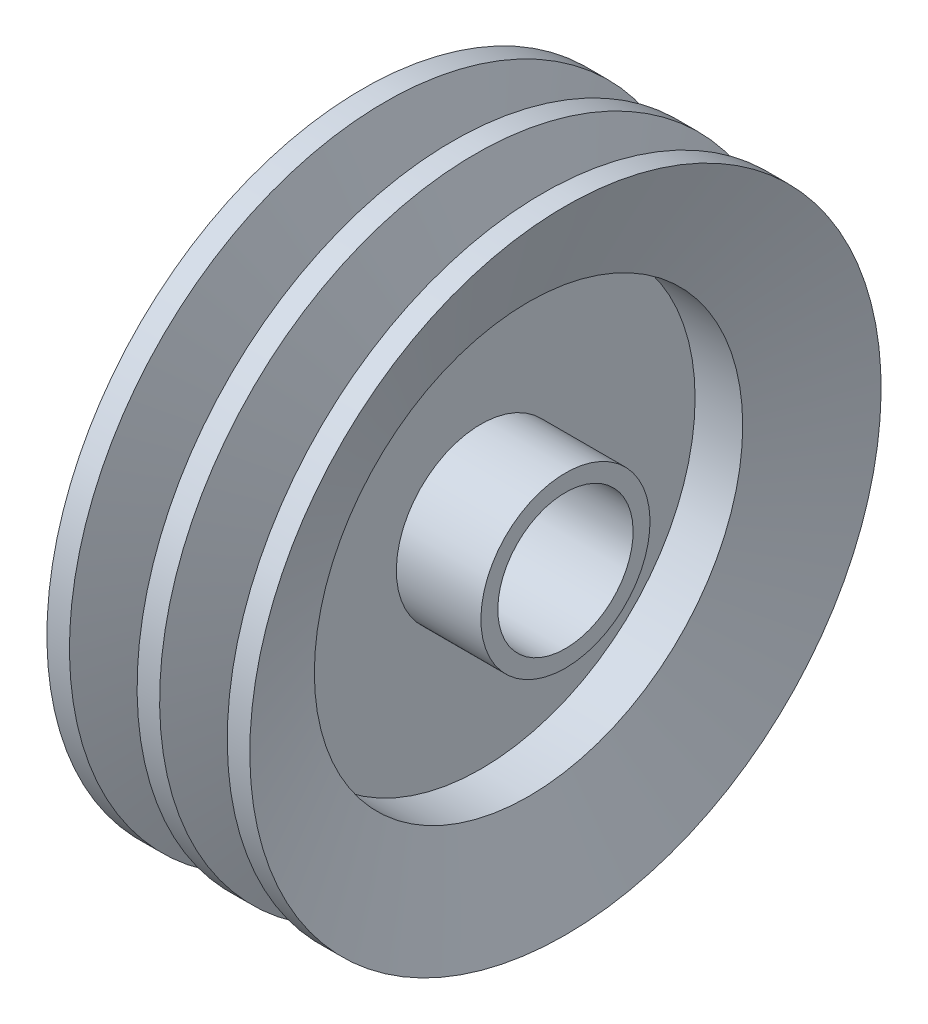
from build123d import *


with BuildPart() as part:
    # Croquis1 → Revolución1 (revolve)
    with BuildSketch(Plane.XY, mode=Mode.PRIVATE) as revoluci_n1_sk:
        Polygon((-45, 30), (45, 30), (45, 37.5), (7.5, 37.5), (7.5, 95), (28.621339458, 95), (45, 140), (35, 140), (24.080892972, 110), (15.919107028, 110), (5, 140), (-5, 140), (-15.919107028, 110), (-24.080892972, 110), (-35, 140), (-45, 140), (-28.621339458, 95), (-7.5, 95), (-7.5, 37.5), (-45, 37.5), align=None)
    revolve(revoluci_n1_sk.sketch.rotate(Axis((-45, 0, 0), (1, 0, 0)), 180), axis=Axis((-45, 0, 0), (1, 0, 0)))


solid = part.part
